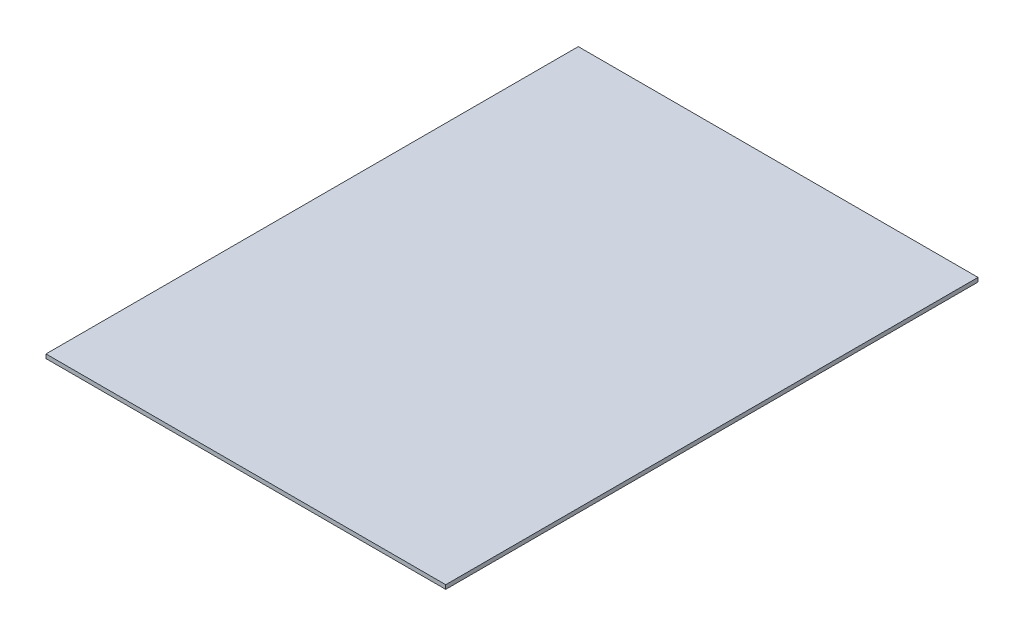
from build123d import *

# Parameters (mm, degrees)
SKETCH1_W           = 622.3
SKETCH1_H           = 828.675
BOSS_EXTRUDE1_DEPTH = 6.35


with BuildPart() as part:
    # Sketch1 → Boss-Extrude1 (new body)
    with BuildSketch(Plane(origin=(0, 0, 0), x_dir=(1, 0, 0), z_dir=(0, 1, 0))):
        with Locations((311.15, 414.3375)):
            Rectangle(SKETCH1_W, SKETCH1_H)
    extrude(amount=BOSS_EXTRUDE1_DEPTH)


solid = part.part
